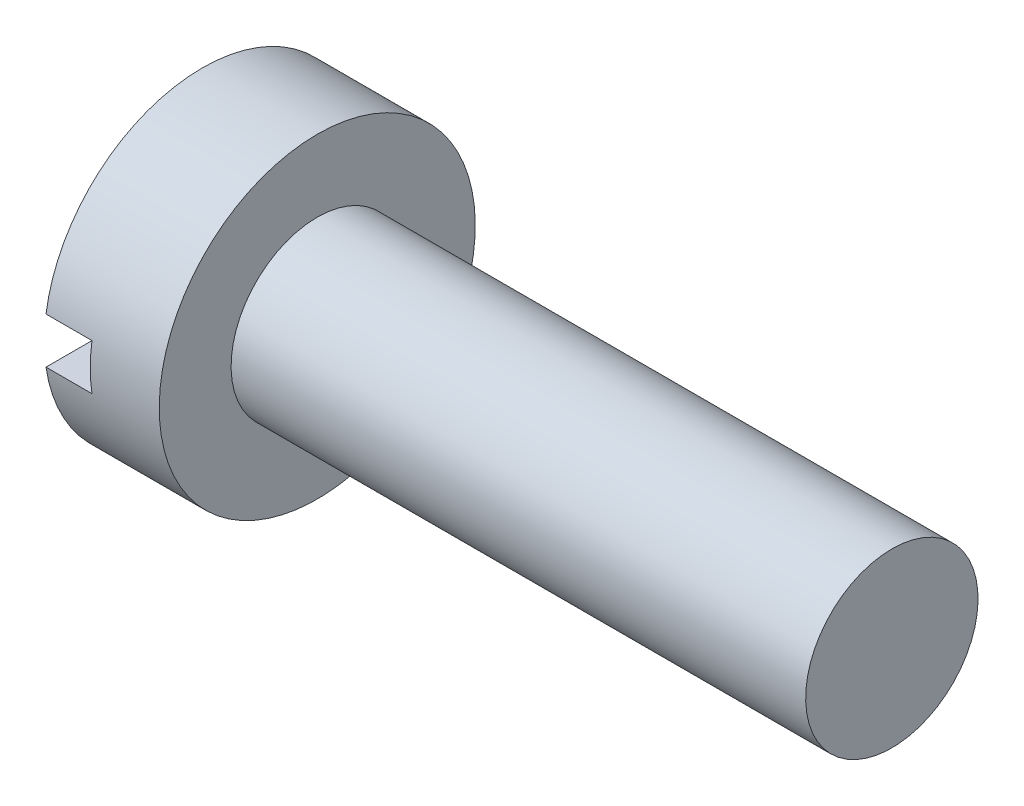
from build123d import *

# Parameters (mm, degrees)
SKETCH2_W          = 5.5
SKETCH2_H          = 0.8
CUT_EXTRUDE1_DEPTH = 0.8


with BuildPart() as part:
    # Sketch1 → Revolve1 (revolve)
    with BuildSketch(Plane.XY):
        Polygon((0, 0), (0, 2.75), (2, 2.75), (2, 1.5), (12, 1.5), (12, 0), align=None)
    revolve(axis=Axis((12, 0, 0), (-1, 0, 0)))

    # Sketch2 → Cut-Extrude1 (cut)
    with BuildSketch(Plane.ZY):
        Rectangle(SKETCH2_W, SKETCH2_H)
    extrude(amount=-CUT_EXTRUDE1_DEPTH, mode=Mode.SUBTRACT)


solid = part.part
